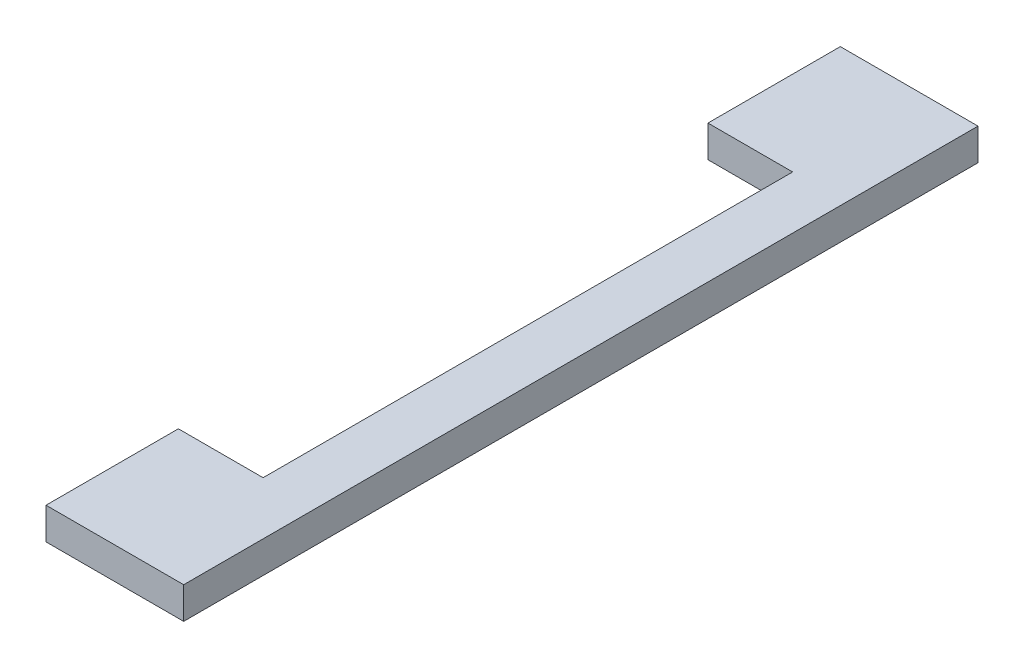
from build123d import *

# Parameters (mm, degrees)
BOSS_EXTRUDE1_DEPTH = 6


with BuildPart() as part:
    # Sketch1 → Boss-Extrude1 (new body)
    with BuildSketch(Plane(origin=(0, 0, 0), x_dir=(1, 0, 0), z_dir=(0, 1, 0))):
        Polygon((-17.4, -19.74), (-17.4, -44.74), (8.6, -44.74), (8.6, 105.26), (-17.4, 105.26), (-17.4, 80.26), (-1.4, 80.26), (-1.4, -19.74), align=None)
    extrude(amount=BOSS_EXTRUDE1_DEPTH)


solid = part.part
